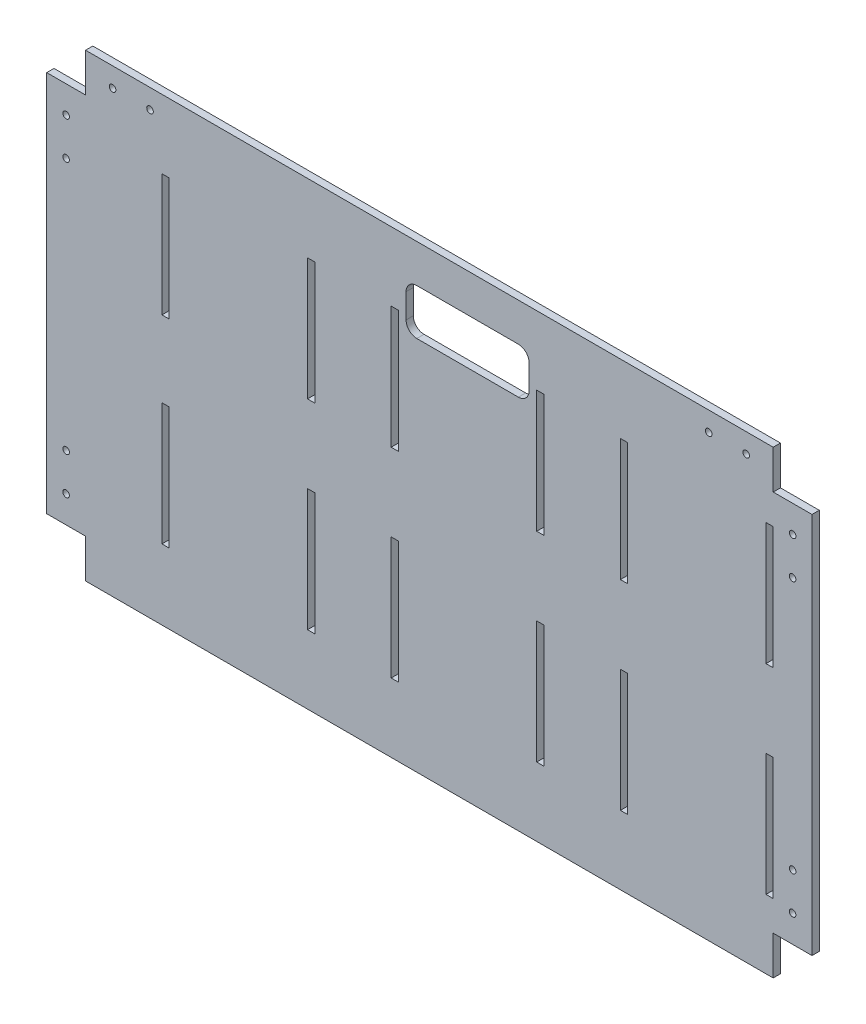
from build123d import *

# Parameters (mm, degrees)
SKETCH_1_W          = 500.8
SKETCH_1_H          = 300.8
EXTRUDE_1_DEPTH     = 4.75
SKETCH_2_W          = 25.4
SKETCH_2_H          = 25.4
SKETCH_2_W_2        = 4.75
SKETCH_2_H_2        = 80
CUT_EXTRUDE_1_DEPTH = 10
SKETCH_3_R          = 2.150000004
SKETCH_3_R_2        = 2.15
CUT_EXTRUDE_2_DEPTH = 5
SKETCH_4_W          = 80.5
SKETCH_4_H          = 30
CUT_EXTRUDE_3_DEPTH = 4.75
FILLET_1_R          = 7


with BuildPart() as part:
    # 草圖1 → 填料-伸長1 (new body)
    with BuildSketch(Plane.XY):
        Rectangle(SKETCH_1_W, SKETCH_1_H)
    extrude(amount=EXTRUDE_1_DEPTH)

    # 草圖2 → 除料-伸長1 (cut)
    with BuildSketch(Plane(origin=(0, 0, 0), x_dir=(-1, 0, 0), z_dir=(0, 0, -1))):
        with Locations((-237.7, 137.7)):
            Rectangle(SKETCH_2_W, SKETCH_2_H)
        with Locations((-237.7, -137.7)):
            Rectangle(SKETCH_2_W, SKETCH_2_H)
        with Locations((237.7, 137.7)):
            Rectangle(SKETCH_2_W, SKETCH_2_H)
        with Locations((237.7, -137.7)):
            Rectangle(SKETCH_2_W, SKETCH_2_H)
        with Locations((-222.625, 65.4)):
            Rectangle(SKETCH_2_W_2, SKETCH_2_H_2)
        with Locations((-222.625, -65.4)):
            Rectangle(SKETCH_2_W_2, SKETCH_2_H_2)
        with Locations((172.625, 65.4)):
            Rectangle(SKETCH_2_W_2, SKETCH_2_H_2)
        with Locations((172.625, -64.4)):
            Rectangle(SKETCH_2_W_2, SKETCH_2_H_2)
        with Locations((-127.375, 65.4)):
            Rectangle(SKETCH_2_W_2, SKETCH_2_H_2)
        with Locations((-72.625, 65.4)):
            Rectangle(SKETCH_2_W_2, SKETCH_2_H_2)
        with Locations((22.625, 65.4)):
            Rectangle(SKETCH_2_W_2, SKETCH_2_H_2)
        with Locations((77.375, 65.4)):
            Rectangle(SKETCH_2_W_2, SKETCH_2_H_2)
        with Locations((77.375, -65.4)):
            Rectangle(SKETCH_2_W_2, SKETCH_2_H_2)
        with Locations((22.625, -65.4)):
            Rectangle(SKETCH_2_W_2, SKETCH_2_H_2)
        with Locations((-127.375, -65.4)):
            Rectangle(SKETCH_2_W_2, SKETCH_2_H_2)
        with Locations((-72.625, -65.4)):
            Rectangle(SKETCH_2_W_2, SKETCH_2_H_2)
    extrude(amount=-CUT_EXTRUDE_1_DEPTH, mode=Mode.SUBTRACT)

    # 草圖3 → 除料-伸長2 (cut)
    with BuildSketch(Plane.XY.offset(4.75)):
        with Locations((-237.7, 107.300000013)):
            Circle(SKETCH_3_R)
        with Locations((-237.7, 82.800000013)):
            Circle(SKETCH_3_R)
        with Locations((-207.3, 137.700000006)):
            Circle(SKETCH_3_R_2)
        with Locations((-182.8, 137.700000006)):
            Circle(SKETCH_3_R_2)
        with Locations((-237.7, -82.800000001)):
            Circle(SKETCH_3_R_2)
        with Locations((-237.7, -107.300000001)):
            Circle(SKETCH_3_R_2)
        with Locations((237.7, -107.300000007)):
            Circle(SKETCH_3_R)
        with Locations((237.7, -82.800000007)):
            Circle(SKETCH_3_R)
        with Locations((237.7, 107.300000006)):
            Circle(SKETCH_3_R_2)
        with Locations((237.7, 82.800000006)):
            Circle(SKETCH_3_R_2)
        with Locations((182.8, 137.700000006)):
            Circle(SKETCH_3_R_2)
        with Locations((207.3, 137.700000006)):
            Circle(SKETCH_3_R_2)
    extrude(amount=-CUT_EXTRUDE_2_DEPTH, mode=Mode.SUBTRACT)

    # 草圖4 → 除料-伸長3 (cut)
    with BuildSketch(Plane.XY.offset(4.75)):
        with Locations((25, 110.4)):
            Rectangle(SKETCH_4_W, SKETCH_4_H)
    extrude(amount=-CUT_EXTRUDE_3_DEPTH, mode=Mode.SUBTRACT)

    # 圓角1
    fillet_1_edges = [part.edges().sort_by_distance(p)[0] for p in [
        (65.25, 125.4, 2.375),
        (65.25, 95.4, 2.375),
        (-15.25, 95.4, 2.375),
        (-15.25, 125.4, 2.375),
    ]]
    fillet(fillet_1_edges, radius=FILLET_1_R)


solid = part.part
